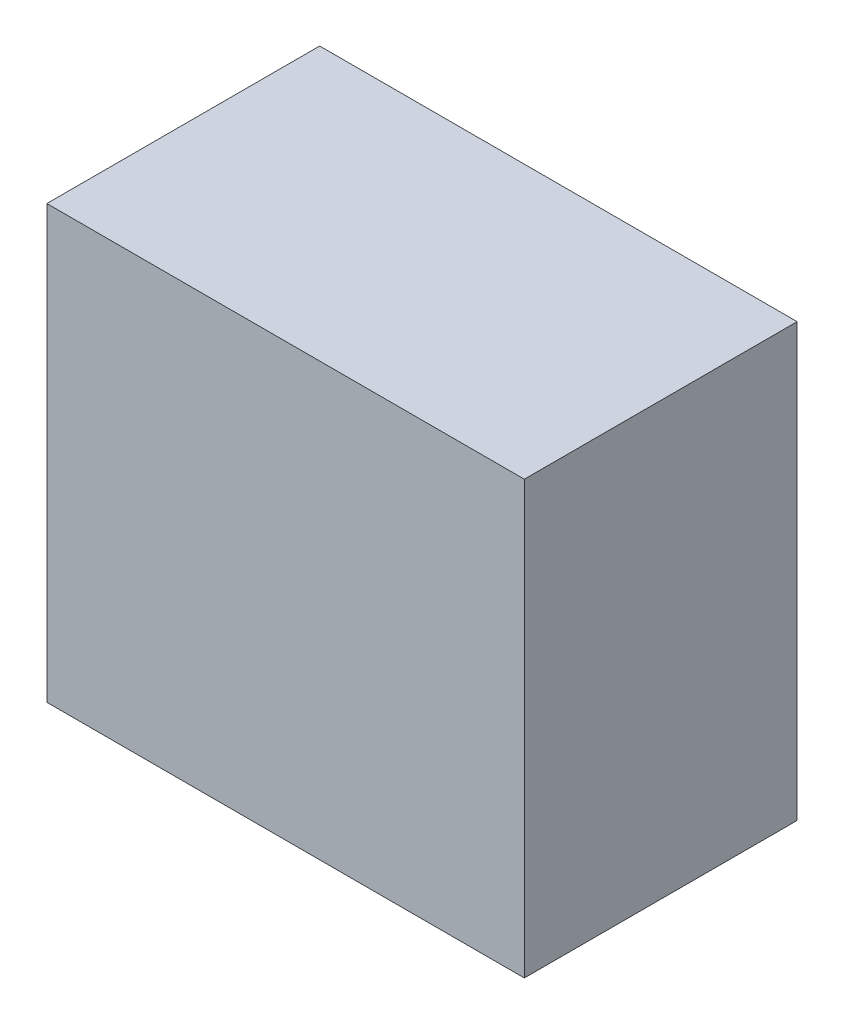
from build123d import *

# Parameters (mm, degrees)
SKETCH_1_W      = 42
SKETCH_1_H      = 38
EXTRUDE_1_DEPTH = 24


with BuildPart() as part:
    # 草图1 → 凸台-拉伸1 (new body)
    with BuildSketch(Plane.XY):
        Rectangle(SKETCH_1_W, SKETCH_1_H)
    extrude(amount=EXTRUDE_1_DEPTH)


solid = part.part
